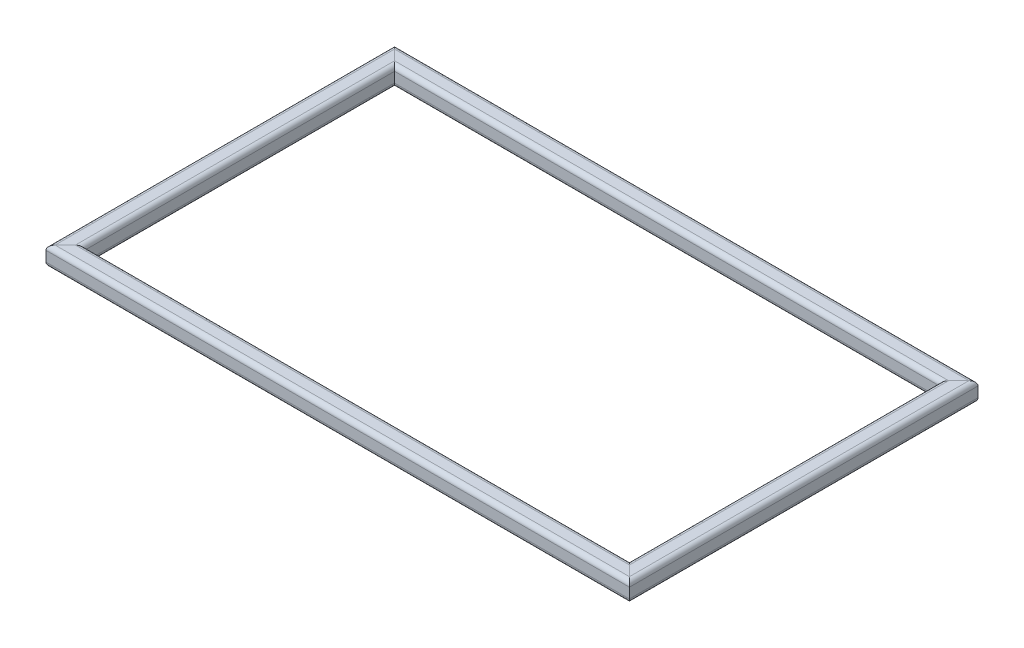
from build123d import *

# Parameters (mm, degrees)
TUBO_CUADRADO_2_X_2_X_0_25_1_DEPTH      = 496.921024484
TUBO_CUADRADO_2_X_2_X_0_25_1_DEPTH_BACK = 36.921024484
TUBO_CUADRADO_2_X_2_X_0_25_1_2_DEPTH    = 843.842048969
TUBO_CUADRADO_2_X_2_X_0_25_1_3_DEPTH    = 533.842048969
TUBO_CUADRADO_2_X_2_X_0_25_1_4_DEPTH    = 843.842048969


with BuildPart() as part:
    # Sketch1 → Tubo cuadrado 2 X 2 X 0.25(1) (new, two sides: drawn at the far end of the back side and taken through both)
    with BuildSketch(Plane(origin=(-372.3, 12.7, -230), x_dir=(1, 0, 0), z_dir=(0, 0, 1)).offset(-TUBO_CUADRADO_2_X_2_X_0_25_1_DEPTH_BACK)):
        with BuildLine():
            Line((-6.7, -12.7), (6.7, -12.7))
            ThreePointArc((6.7, -12.7), (10.942640687, -10.942640687), (12.7, -6.7))
            Line((12.7, -6.7), (12.7, 6.7))
            ThreePointArc((12.7, 6.7), (10.942640687, 10.942640687), (6.7, 12.7))
            Line((6.7, 12.7), (-6.7, 12.7))
            ThreePointArc((-6.7, 12.7), (-10.942640687, 10.942640687), (-12.7, 6.7))
            Line((-12.7, 6.7), (-12.7, -6.7))
            ThreePointArc((-12.7, -6.7), (-10.942640687, -10.942640687), (-6.7, -12.7))
        make_face()
        with BuildLine():
            Line((-6.7, -9.7), (6.7, -9.7))
            ThreePointArc((6.7, -9.7), (8.821320344, -8.821320344), (9.7, -6.7))
            Line((9.7, -6.7), (9.7, 6.7))
            ThreePointArc((9.7, 6.7), (8.821320344, 8.821320344), (6.7, 9.7))
            Line((6.7, 9.7), (-6.7, 9.7))
            ThreePointArc((-6.7, 9.7), (-8.821320344, 8.821320344), (-9.7, 6.7))
            Line((-9.7, 6.7), (-9.7, -6.7))
            ThreePointArc((-9.7, -6.7), (-8.821320344, -8.821320344), (-6.7, -9.7))
        make_face(mode=Mode.SUBTRACT)
    extrude(amount=TUBO_CUADRADO_2_X_2_X_0_25_1_DEPTH + TUBO_CUADRADO_2_X_2_X_0_25_1_DEPTH_BACK)

    # Tubo cuadrado 2 X 2 X 0.25(1) mitre 1
    split(bisect_by=Plane(origin=(-385, 0, -230), x_dir=(0, -1, 0), z_dir=(-0.707106781, 0, 0.707106781)), keep=Keep.TOP)

    # Tubo cuadrado 2 X 2 X 0.25(1) mitre 2
    split(bisect_by=Plane(origin=(-385, 0, 230), x_dir=(0, -1, 0), z_dir=(-0.707106781, 0, -0.707106781)), keep=Keep.TOP)


with BuildPart() as body_2:
    # Sketch1 on segment 2 (carried to segment 2) → Tubo cuadrado 2 X 2 X 0.25_1 2 (new body)
    with BuildSketch(Plane(origin=(-421.921024484, 12.7, 217.3), x_dir=(0, 0, -1), z_dir=(1, 0, 0))):
        with BuildLine():
            Line((-6.7, -12.7), (6.7, -12.7))
            ThreePointArc((6.7, -12.7), (10.942640687, -10.942640687), (12.7, -6.7))
            Line((12.7, -6.7), (12.7, 6.7))
            ThreePointArc((12.7, 6.7), (10.942640687, 10.942640687), (6.7, 12.7))
            Line((6.7, 12.7), (-6.7, 12.7))
            ThreePointArc((-6.7, 12.7), (-10.942640687, 10.942640687), (-12.7, 6.7))
            Line((-12.7, 6.7), (-12.7, -6.7))
            ThreePointArc((-12.7, -6.7), (-10.942640687, -10.942640687), (-6.7, -12.7))
        make_face()
        with BuildLine():
            Line((-6.7, -9.7), (6.7, -9.7))
            ThreePointArc((6.7, -9.7), (8.821320344, -8.821320344), (9.7, -6.7))
            Line((9.7, -6.7), (9.7, 6.7))
            ThreePointArc((9.7, 6.7), (8.821320344, 8.821320344), (6.7, 9.7))
            Line((6.7, 9.7), (-6.7, 9.7))
            ThreePointArc((-6.7, 9.7), (-8.821320344, 8.821320344), (-9.7, 6.7))
            Line((-9.7, 6.7), (-9.7, -6.7))
            ThreePointArc((-9.7, -6.7), (-8.821320344, -8.821320344), (-6.7, -9.7))
        make_face(mode=Mode.SUBTRACT)
    extrude(amount=TUBO_CUADRADO_2_X_2_X_0_25_1_2_DEPTH)

    # Tubo cuadrado 2 X 2 X 0.25_1 2 mitre 1
    split(bisect_by=Plane(origin=(-385, 0, 230), x_dir=(0, 1, 0), z_dir=(0.707106781, 0, 0.707106781)), keep=Keep.TOP)

    # Tubo cuadrado 2 X 2 X 0.25_1 2 mitre 2
    split(bisect_by=Plane(origin=(385, 0, 230), x_dir=(0, -1, 0), z_dir=(-0.707106781, 0, 0.707106781)), keep=Keep.TOP)


with BuildPart() as body_3:
    # Sketch1 on segment 3 (carried to segment 3) → Tubo cuadrado 2 X 2 X 0.25_1 3 (new body)
    with BuildSketch(Plane(origin=(372.3, 12.7, 266.921024484), x_dir=(-1, 0, 0), z_dir=(0, 0, -1))):
        with BuildLine():
            Line((-6.7, -12.7), (6.7, -12.7))
            ThreePointArc((6.7, -12.7), (10.942640687, -10.942640687), (12.7, -6.7))
            Line((12.7, -6.7), (12.7, 6.7))
            ThreePointArc((12.7, 6.7), (10.942640687, 10.942640687), (6.7, 12.7))
            Line((6.7, 12.7), (-6.7, 12.7))
            ThreePointArc((-6.7, 12.7), (-10.942640687, 10.942640687), (-12.7, 6.7))
            Line((-12.7, 6.7), (-12.7, -6.7))
            ThreePointArc((-12.7, -6.7), (-10.942640687, -10.942640687), (-6.7, -12.7))
        make_face()
        with BuildLine():
            Line((-6.7, -9.7), (6.7, -9.7))
            ThreePointArc((6.7, -9.7), (8.821320344, -8.821320344), (9.7, -6.7))
            Line((9.7, -6.7), (9.7, 6.7))
            ThreePointArc((9.7, 6.7), (8.821320344, 8.821320344), (6.7, 9.7))
            Line((6.7, 9.7), (-6.7, 9.7))
            ThreePointArc((-6.7, 9.7), (-8.821320344, 8.821320344), (-9.7, 6.7))
            Line((-9.7, 6.7), (-9.7, -6.7))
            ThreePointArc((-9.7, -6.7), (-8.821320344, -8.821320344), (-6.7, -9.7))
        make_face(mode=Mode.SUBTRACT)
    extrude(amount=TUBO_CUADRADO_2_X_2_X_0_25_1_3_DEPTH)

    # Tubo cuadrado 2 X 2 X 0.25_1 3 mitre 1
    split(bisect_by=Plane(origin=(385, 0, -230), x_dir=(0, 1, 0), z_dir=(0.707106781, 0, 0.707106781)), keep=Keep.TOP)

    # Tubo cuadrado 2 X 2 X 0.25_1 3 mitre 2
    split(bisect_by=Plane(origin=(385, 0, 230), x_dir=(0, 1, 0), z_dir=(0.707106781, 0, -0.707106781)), keep=Keep.TOP)


with BuildPart() as body_4:
    # Sketch1 on segment 4 (carried to segment 4) → Tubo cuadrado 2 X 2 X 0.25_1 4 (new body)
    with BuildSketch(Plane(origin=(421.921024484, 12.7, -217.3), x_dir=(0, 0, 1), z_dir=(-1, 0, 0))):
        with BuildLine():
            Line((-6.7, -12.7), (6.7, -12.7))
            ThreePointArc((6.7, -12.7), (10.942640687, -10.942640687), (12.7, -6.7))
            Line((12.7, -6.7), (12.7, 6.7))
            ThreePointArc((12.7, 6.7), (10.942640687, 10.942640687), (6.7, 12.7))
            Line((6.7, 12.7), (-6.7, 12.7))
            ThreePointArc((-6.7, 12.7), (-10.942640687, 10.942640687), (-12.7, 6.7))
            Line((-12.7, 6.7), (-12.7, -6.7))
            ThreePointArc((-12.7, -6.7), (-10.942640687, -10.942640687), (-6.7, -12.7))
        make_face()
        with BuildLine():
            Line((-6.7, -9.7), (6.7, -9.7))
            ThreePointArc((6.7, -9.7), (8.821320344, -8.821320344), (9.7, -6.7))
            Line((9.7, -6.7), (9.7, 6.7))
            ThreePointArc((9.7, 6.7), (8.821320344, 8.821320344), (6.7, 9.7))
            Line((6.7, 9.7), (-6.7, 9.7))
            ThreePointArc((-6.7, 9.7), (-8.821320344, 8.821320344), (-9.7, 6.7))
            Line((-9.7, 6.7), (-9.7, -6.7))
            ThreePointArc((-9.7, -6.7), (-8.821320344, -8.821320344), (-6.7, -9.7))
        make_face(mode=Mode.SUBTRACT)
    extrude(amount=TUBO_CUADRADO_2_X_2_X_0_25_1_4_DEPTH)

    # Tubo cuadrado 2 X 2 X 0.25_1 4 mitre 1
    split(bisect_by=Plane(origin=(-385, 0, -230), x_dir=(0, 1, 0), z_dir=(0.707106781, 0, -0.707106781)), keep=Keep.TOP)

    # Tubo cuadrado 2 X 2 X 0.25_1 4 mitre 2
    split(bisect_by=Plane(origin=(385, 0, -230), x_dir=(0, -1, 0), z_dir=(-0.707106781, 0, -0.707106781)), keep=Keep.TOP)


solid = Compound([part.part, body_2.part, body_3.part, body_4.part])
